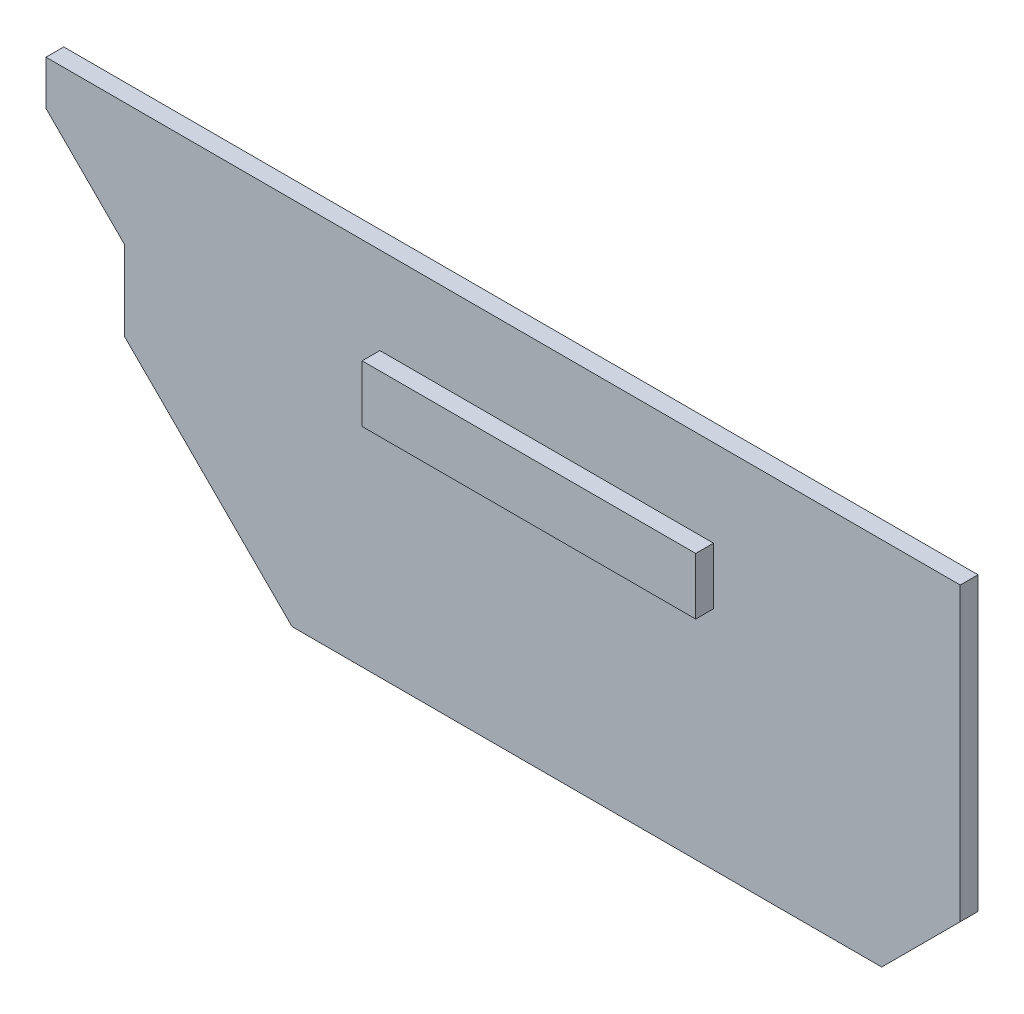
from build123d import *

# Parameters (mm, degrees)
BOSS_EXTRUDE1_DEPTH = 2.4
SKETCH2_W           = 45.06
SKETCH2_H           = 7.68
BOSS_EXTRUDE2_DEPTH = 2.4


with BuildPart() as part:
    # Sketch1 → Boss-Extrude1 (new body)
    with BuildSketch(Plane.XY):
        Polygon((0, 0), (123.5, 0), (123.5, -39.393398282), (112.893398282, -50), (33.234018716, -50), (10.606601718, -27.372583002), (10.606601718, -16.606601718), (0, -6), align=None)
    extrude(amount=BOSS_EXTRUDE1_DEPTH)

    # Sketch2 → Boss-Extrude2 (add)
    with BuildSketch(Plane.XY.offset(2.4)):
        with Locations((67.636601718, -15.61)):
            Rectangle(SKETCH2_W, SKETCH2_H)
    extrude(amount=BOSS_EXTRUDE2_DEPTH)


solid = part.part
